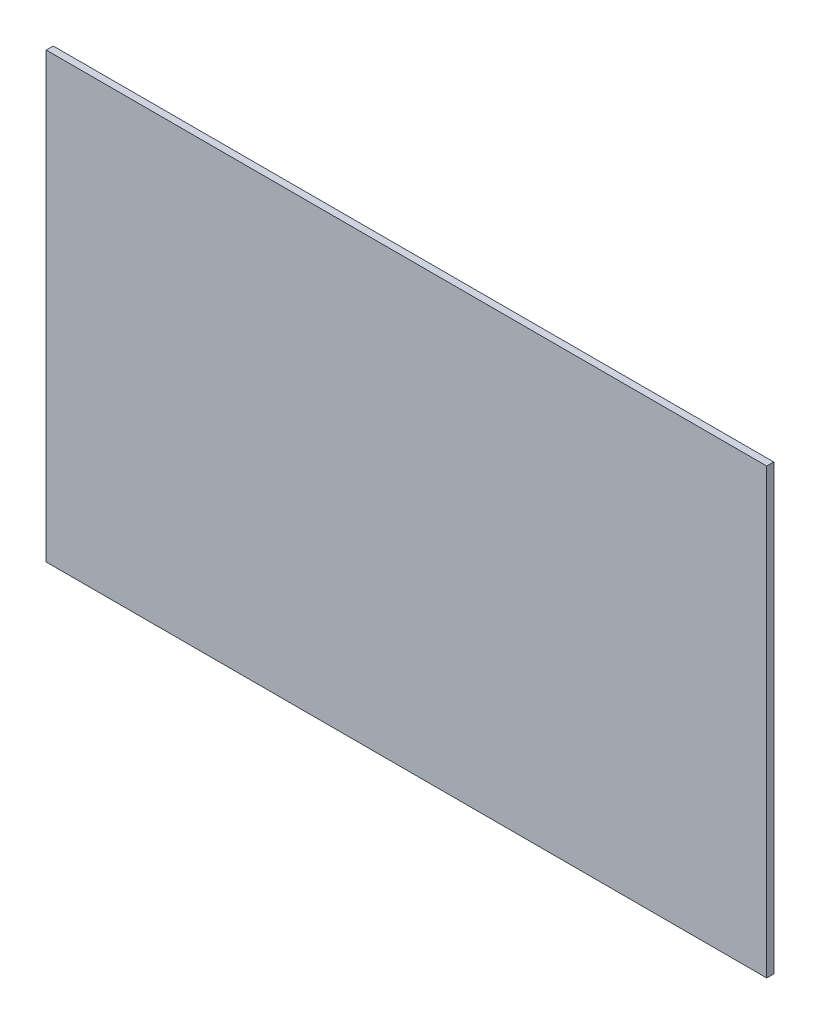
from build123d import *

# Parameters (mm, degrees)
CROQUIS1_W              = 650
CROQUIS1_H              = 400
SALIENTE_EXTRUIR1_DEPTH = 6.35


with BuildPart() as part:
    # Croquis1 → Saliente-Extruir1 (new body)
    with BuildSketch(Plane.XY):
        with Locations((325, 200)):
            Rectangle(CROQUIS1_W, CROQUIS1_H)
    extrude(amount=SALIENTE_EXTRUIR1_DEPTH)


solid = part.part
